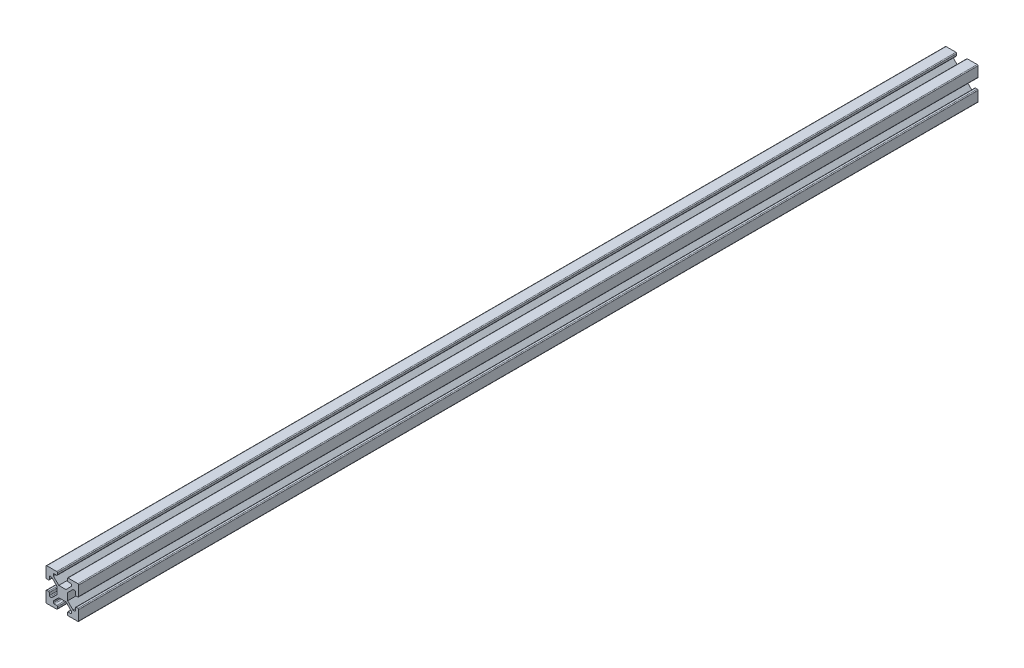
from build123d import *

# Parameters (mm, degrees)
EXTRUDE_1_DEPTH = 550


with BuildPart() as part:
    # 草图1 → 凸台-拉伸1 (new body)
    with BuildSketch(Plane.XY):
        with BuildLine():
            Line((6.5, 0), (0.5, 0))
            ThreePointArc((0.5, 0), (0.146446609, -0.146446609), (0, -0.5))
            Line((0, -0.5), (0, -6.5))
            ThreePointArc((0, -6.5), (0.146446609, -6.853553391), (0.5, -7))
            Line((0.5, -7), (1.5, -7))
            ThreePointArc((1.5, -7), (1.853553391, -6.853553391), (2, -6.5))
            Line((2, -6.5), (2, -5))
            ThreePointArc((2, -5), (2.146446609, -4.646446609), (2.5, -4.5))
            Line((2.5, -4.5), (3.220918534, -4.5))
            ThreePointArc((3.220918534, -4.5), (3.412260251, -4.538060234), (3.574471925, -4.646446609))
            Line((3.574471925, -4.646446609), (6.741642787, -7.813617472))
            Line((6.741642787, -7.813617472), (6.741642787, -12.186382528))
            Line((6.741642787, -12.186382528), (3.574471925, -15.353553391))
            ThreePointArc((3.574471925, -15.353553391), (3.412260251, -15.461939766), (3.220918534, -15.5))
            Line((3.220918534, -15.5), (2.5, -15.5))
            ThreePointArc((2.5, -15.5), (2.146446609, -15.353553391), (2, -15))
            Line((2, -15), (2, -13.5))
            ThreePointArc((2, -13.5), (1.853553391, -13.146446609), (1.5, -13))
            Line((1.5, -13), (0.5, -13))
            ThreePointArc((0.5, -13), (0.146446609, -13.146446609), (0, -13.5))
            Line((0, -13.5), (0, -19.5))
            ThreePointArc((0, -19.5), (0.146446609, -19.853553391), (0.5, -20))
            Line((0.5, -20), (6.5, -20))
            ThreePointArc((6.5, -20), (6.853553391, -19.853553391), (7, -19.5))
            Line((7, -19.5), (7, -18.5))
            ThreePointArc((7, -18.5), (6.853553391, -18.146446609), (6.5, -18))
            Line((6.5, -18), (5, -18))
            ThreePointArc((5, -18), (4.646446609, -17.853553391), (4.5, -17.5))
            Line((4.5, -17.5), (4.5, -16.779081466))
            ThreePointArc((4.5, -16.779081466), (4.538060234, -16.587739749), (4.646446609, -16.425528075))
            Line((4.646446609, -16.425528075), (7.667170862, -13.404803822))
            ThreePointArc((7.667170862, -13.404803822), (7.829382537, -13.296417446), (8.020724253, -13.258357213))
            Line((8.020724253, -13.258357213), (11.979275747, -13.258357213))
            ThreePointArc((11.979275747, -13.258357213), (12.170617463, -13.296417446), (12.332829138, -13.404803822))
            Line((12.332829138, -13.404803822), (15.353553391, -16.425528075))
            ThreePointArc((15.353553391, -16.425528075), (15.461939766, -16.587739749), (15.5, -16.779081466))
            Line((15.5, -16.779081466), (15.5, -17.5))
            ThreePointArc((15.5, -17.5), (15.353553391, -17.853553391), (15, -18))
            Line((15, -18), (13.5, -18))
            ThreePointArc((13.5, -18), (13.146446609, -18.146446609), (13, -18.5))
            Line((13, -18.5), (13, -19.5))
            ThreePointArc((13, -19.5), (13.146446609, -19.853553391), (13.5, -20))
            Line((13.5, -20), (19.5, -20))
            ThreePointArc((19.5, -20), (19.853553391, -19.853553391), (20, -19.5))
            Line((20, -19.5), (20, -13.5))
            ThreePointArc((20, -13.5), (19.853553391, -13.146446609), (19.5, -13))
            Line((19.5, -13), (18.5, -13))
            ThreePointArc((18.5, -13), (18.146446609, -13.146446609), (18, -13.5))
            Line((18, -13.5), (18, -15))
            ThreePointArc((18, -15), (17.853553391, -15.353553391), (17.5, -15.5))
            Line((17.5, -15.5), (16.779081466, -15.5))
            ThreePointArc((16.779081466, -15.5), (16.587739749, -15.461939766), (16.425528075, -15.353553391))
            Line((16.425528075, -15.353553391), (13.258357213, -12.186382528))
            Line((13.258357213, -12.186382528), (13.258357213, -7.813617472))
            Line((13.258357213, -7.813617472), (16.425528075, -4.646446609))
            ThreePointArc((16.425528075, -4.646446609), (16.587739749, -4.538060234), (16.779081466, -4.5))
            Line((16.779081466, -4.5), (17.5, -4.5))
            ThreePointArc((17.5, -4.5), (17.853553391, -4.646446609), (18, -5))
            Line((18, -5), (18, -6.5))
            ThreePointArc((18, -6.5), (18.146446609, -6.853553391), (18.5, -7))
            Line((18.5, -7), (19.5, -7))
            ThreePointArc((19.5, -7), (19.853553391, -6.853553391), (20, -6.5))
            Line((20, -6.5), (20, -0.5))
            ThreePointArc((20, -0.5), (19.853553391, -0.146446609), (19.5, 0))
            Line((19.5, 0), (13.5, 0))
            ThreePointArc((13.5, 0), (13.146446609, -0.146446609), (13, -0.5))
            Line((13, -0.5), (13, -1.5))
            ThreePointArc((13, -1.5), (13.146446609, -1.853553391), (13.5, -2))
            Line((13.5, -2), (15, -2))
            ThreePointArc((15, -2), (15.353553391, -2.146446609), (15.5, -2.5))
            Line((15.5, -2.5), (15.5, -3.220918534))
            ThreePointArc((15.5, -3.220918534), (15.461939766, -3.412260251), (15.353553391, -3.574471925))
            Line((15.353553391, -3.574471925), (12.186382528, -6.741642787))
            Line((12.186382528, -6.741642787), (7.813617472, -6.741642787))
            Line((7.813617472, -6.741642787), (4.646446609, -3.574471925))
            ThreePointArc((4.646446609, -3.574471925), (4.538060234, -3.412260251), (4.5, -3.220918534))
            Line((4.5, -3.220918534), (4.5, -2.5))
            ThreePointArc((4.5, -2.5), (4.646446609, -2.146446609), (5, -2))
            Line((5, -2), (6.5, -2))
            ThreePointArc((6.5, -2), (6.853553391, -1.853553391), (7, -1.5))
            Line((7, -1.5), (7, -0.5))
            ThreePointArc((7, -0.5), (6.853553391, -0.146446609), (6.5, 0))
        make_face()
    extrude(amount=EXTRUDE_1_DEPTH)


solid = part.part
